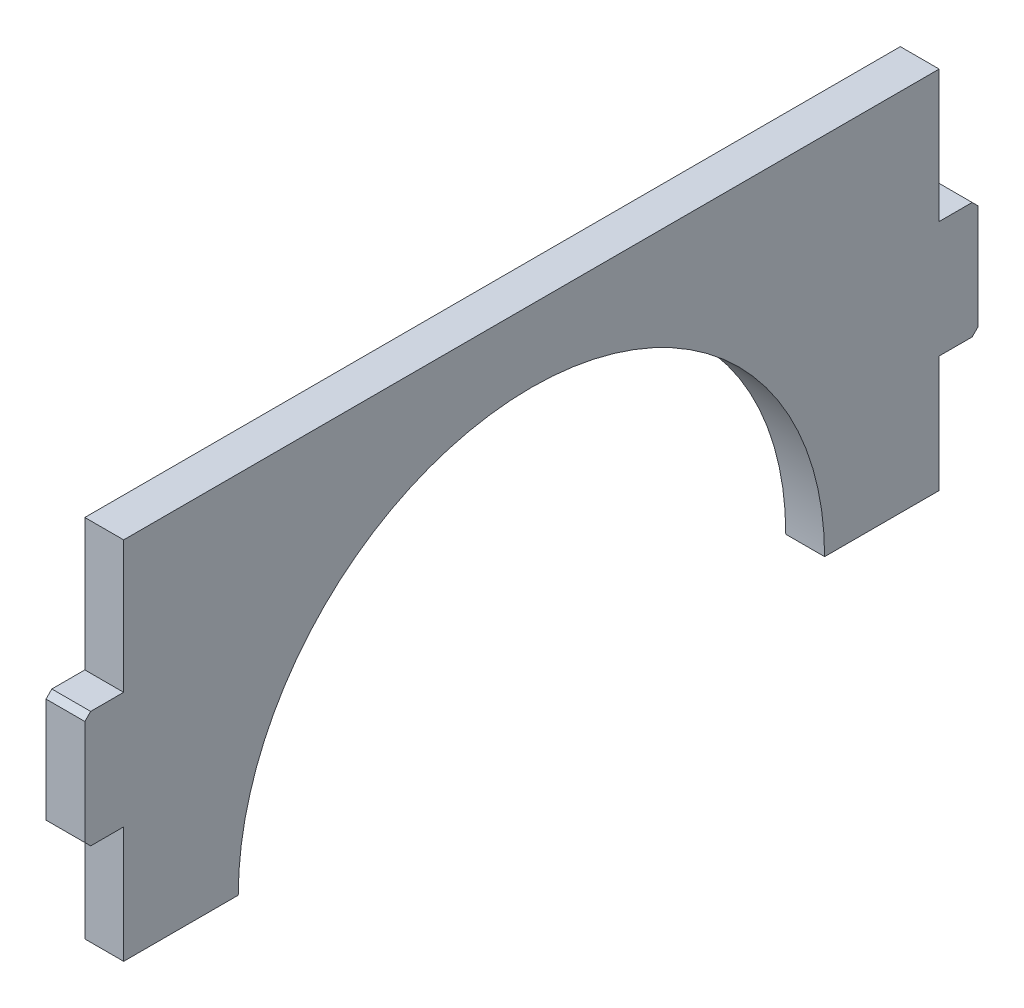
from build123d import *

# Parameters (mm, degrees)
EXTRUDE_583_DEPTH              = 5
SKETCH_2_W                     = 10
SKETCH_2_H                     = 30
EXTRUDE_642_DEPTH              = 5
CHAMFER_690_SIZE               = 1.5
CHAMFER_690_OF_MIRROR_757_SIZE = 1.5


with BuildPart() as part:
    # ｽｹｯﾁ1 → Extrude 583 (new, symmetric)
    with BuildSketch(Plane(origin=(0, 0, 0), x_dir=(0, 0, -1), z_dir=(1, 0, 0))):
        with BuildLine():
            Line((75.5, 0), (105, 0))
            Line((105, 0), (105, 94))
            Line((105, 94), (-105, 94))
            Line((-105, 94), (-105, 0))
            Line((-105, 0), (-75.5, 0))
            ThreePointArc((-75.5, 0), (0, 75.5), (75.5, 0))
        make_face()
    extrude(amount=EXTRUDE_583_DEPTH, both=True)

    # ｽｹｯﾁ2 → Extrude 642 (add, symmetric)
    with BuildSketch(Plane(origin=(0, 0, 0), x_dir=(0, 0, -1), z_dir=(1, 0, 0))):
        with Locations((-110, 45)):
            Rectangle(SKETCH_2_W, SKETCH_2_H)
    extrude_642 = extrude(amount=EXTRUDE_642_DEPTH, both=True)

    # Chamfer 690
    chamfer_690_edges = [part.edges().sort_by_distance(p)[0] for p in [
        (0, 60, 115),
        (0, 30, 115),
    ]]
    chamfer(chamfer_690_edges, length=CHAMFER_690_SIZE)

    # Mirror 757: Extrude 642 across plane
    add(extrude_642.mirror(Plane.XY))

    # Chamfer 690 of Mirror 757
    chamfer_690_of_mirror_757_edges = [part.edges().sort_by_distance(p)[0] for p in [
        (0, 60, -115),
        (0, 30, -115),
    ]]
    chamfer(chamfer_690_of_mirror_757_edges, length=CHAMFER_690_OF_MIRROR_757_SIZE)


solid = part.part
